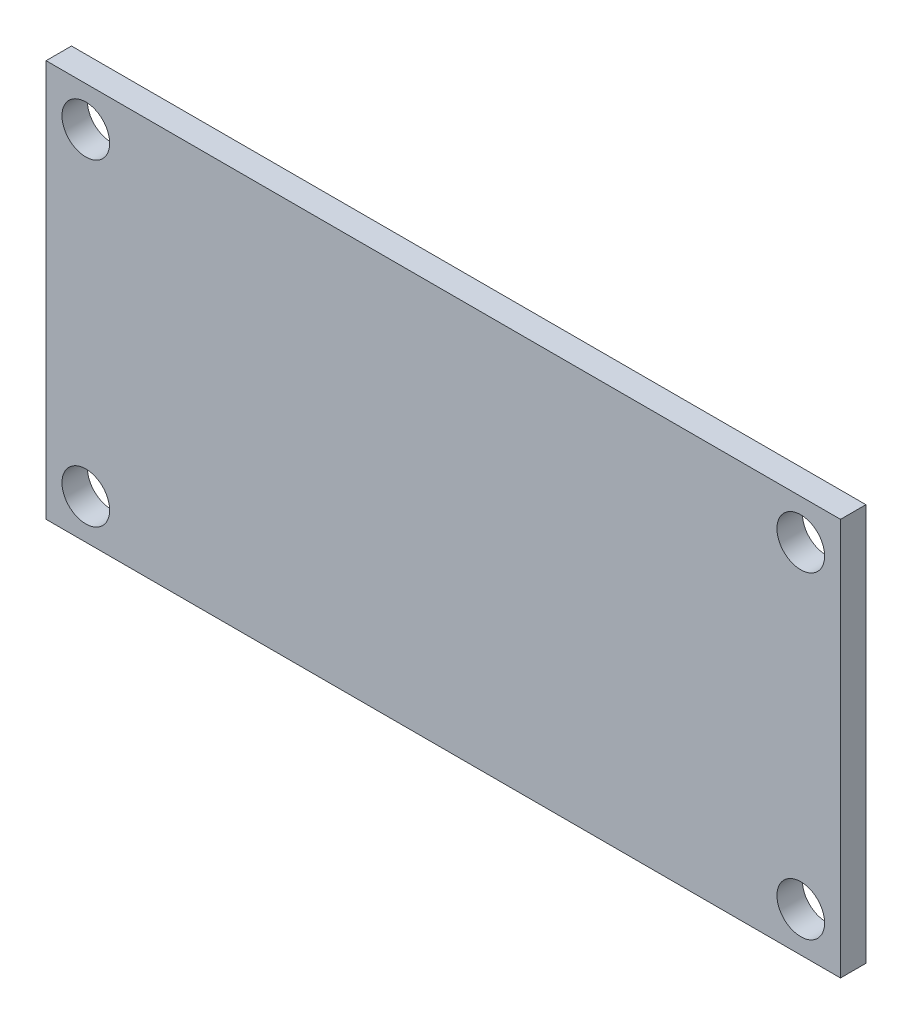
from build123d import *

# Parameters (mm, degrees)
SKETCH1_W           = 50
SKETCH1_H           = 25
BOSS_EXTRUDE1_DEPTH = 1.6
SKETCH2_R           = 1.5
CUT_EXTRUDE1_DEPTH  = 1.6


with BuildPart() as part:
    # Sketch1 → Boss-Extrude1 (new body)
    with BuildSketch(Plane.XY):
        with Locations((25, 12.5)):
            Rectangle(SKETCH1_W, SKETCH1_H)
    extrude(amount=BOSS_EXTRUDE1_DEPTH)

    # Sketch2 → Cut-Extrude1 (cut)
    with BuildSketch(Plane(origin=(0, 0, 0), x_dir=(-1, 0, 0), z_dir=(0, 0, -1))):
        with Locations((-2.5, 2.5)):
            Circle(SKETCH2_R)
        with Locations((-47.5, 2.5)):
            Circle(SKETCH2_R)
        with Locations((-47.5, 22.5)):
            Circle(SKETCH2_R)
        with Locations((-2.5, 22.5)):
            Circle(SKETCH2_R)
    extrude(amount=-CUT_EXTRUDE1_DEPTH, mode=Mode.SUBTRACT)


solid = part.part
